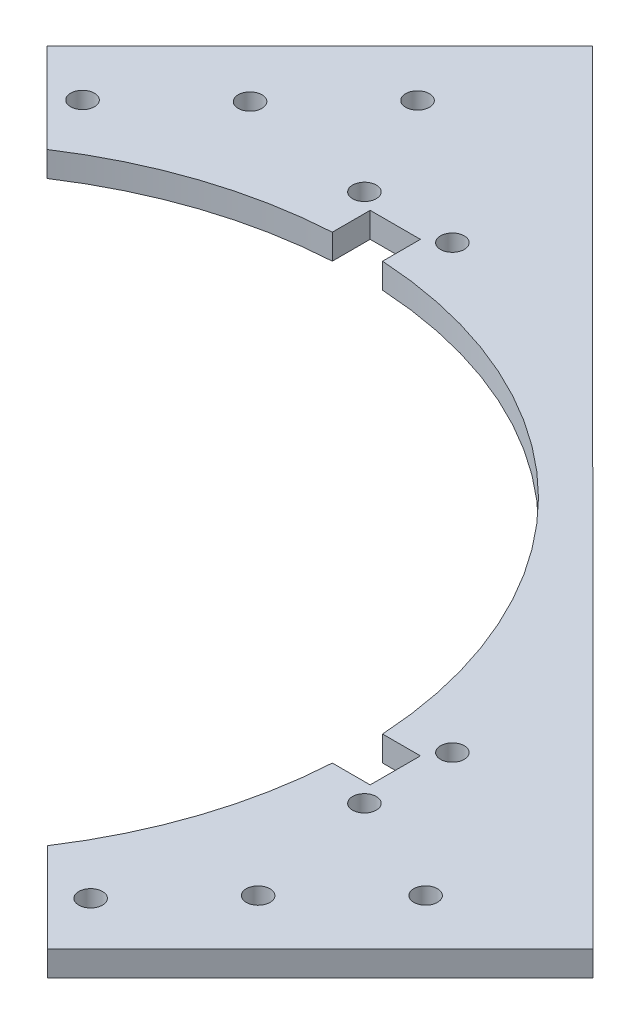
from build123d import *

# Parameters (mm, degrees)
SKETCH1_R           = 1.5
SKETCH1_R_2         = 55
BOSS_EXTRUDE1_DEPTH = 3.175
CUT_EXTRUDE3_DEPTH  = 140.736059076
CUT_EXTRUDE4_DEPTH  = 140.736059076
CUT_EXTRUDE5_DEPTH  = 140.736059076
SKETCH6_R           = 1.5
CUT_EXTRUDE6_DEPTH  = 130.738840902
CUT_EXTRUDE7_DEPTH  = 10


with BuildPart() as part:
    # Sketch1 → Boss-Extrude1 (new body)
    with BuildSketch(Plane(origin=(0, 0, 0), x_dir=(1, 0, 0), z_dir=(0, 1, 0))):
        Polygon((0.047005036, -98.782806148), (-98.782806148, -0.047005036), (-0.047005036, 98.782806148), (98.782806148, 0.047005036), align=None)
        with Locations(Location((-61.346730494, 5.55625, 0), (0, 0, 270))):
            Circle(SKETCH1_R, mode=Mode.SUBTRACT)
        with Locations(Location((-61.346730494, -5.55625, 0), (0, 0, 270))):
            Circle(SKETCH1_R, mode=Mode.SUBTRACT)
        with Locations(Location((-5.55625, -61.346730494, 0), (0, 0, 270))):
            Circle(SKETCH1_R, mode=Mode.SUBTRACT)
        with Locations(Location((5.55625, -61.346730494, 0), (0, 0, 270))):
            Circle(SKETCH1_R, mode=Mode.SUBTRACT)
        with Locations(Location((61.346730494, -5.55625, 0), (0, 0, 270))):
            Circle(SKETCH1_R, mode=Mode.SUBTRACT)
        with Locations(Location((61.346730494, 5.55625, 0), (0, 0, 270))):
            Circle(SKETCH1_R, mode=Mode.SUBTRACT)
        with Locations(Location((5.55625, 61.346730494, 0), (0, 0, 270))):
            Circle(SKETCH1_R, mode=Mode.SUBTRACT)
        with Locations(Location((-5.55625, 61.346730494, 0), (0, 0, 270))):
            Circle(SKETCH1_R, mode=Mode.SUBTRACT)
        with Locations(Location((0, 0, 0), (0, 0, 270))):
            Circle(SKETCH1_R_2, mode=Mode.SUBTRACT)
    extrude(amount=BOSS_EXTRUDE1_DEPTH)

    # Sketch2 → Cut-Extrude3 (cut, through all)
    with BuildSketch(Plane(origin=(0, 3.175, 0), x_dir=(1, 0, 0), z_dir=(0, 1, 0))):
        Polygon((3.175, 53.34), (3.175, 59.69), (-3.175, 59.69), (-3.175, 53.34), (-3.175, 52.244537665), (3.175, 52.244537665), align=None)
        Polygon((53.34, -3.175), (59.69, -3.175), (59.69, 3.175), (53.34, 3.175), (52.244537665, 3.175), (52.244537665, -3.175), align=None)
        Polygon((-3.175, -53.34), (-3.175, -59.69), (3.175, -59.69), (3.175, -53.34), (3.175, -52.244537665), (-3.175, -52.244537665), align=None)
        Polygon((-53.34, 3.175), (-59.69, 3.175), (-59.69, -3.175), (-53.34, -3.175), (-52.244537665, -3.175), (-52.244537665, 3.175), align=None)
    extrude(amount=-CUT_EXTRUDE3_DEPTH, mode=Mode.SUBTRACT)

    # Sketch3 → Cut-Extrude4 (cut, through all)
    with BuildSketch(Plane(origin=(0, 3.175, 0), x_dir=(1, 0, 0), z_dir=(0, 1, 0))):
        Polygon((-49.414905592, 49.367900556), (49.414905592, -49.367900556), (0.047005036, -98.782806148), (-98.782806148, -0.047005036), align=None)
    extrude(amount=-CUT_EXTRUDE4_DEPTH, mode=Mode.SUBTRACT)

    # Sketch5 → Cut-Extrude5 (cut, through all)
    with BuildSketch(Plane(origin=(0, 3.175, 0), x_dir=(1, 0, 0), z_dir=(0, 1, 0))):
        Polygon((98.782806148, 0.047005036), (91.71510385, -7.027426688), (-7.114707335, 91.708374424), (-0.047005036, 98.782806148), align=None)
    extrude(amount=-CUT_EXTRUDE5_DEPTH, mode=Mode.SUBTRACT)

    # Sketch6 → Cut-Extrude6 (cut, through all)
    with BuildSketch(Plane(origin=(0, 3.175, 0), x_dir=(1, 0, 0), z_dir=(0, 1, 0))):
        with Locations(Location((64.725061333, -22.363275374, 0), (0, 0, 270))):
            Circle(SKETCH6_R)
        with Locations(Location((75.300110897, -11.778156907, 0), (0, 0, 270))):
            Circle(SKETCH6_R)
        with Locations(Location((-12.20223816, 74.702563661, 0), (0, 0, 90))):
            Circle(SKETCH6_R)
        with Locations(Location((-22.662437607, 64.003936002, 0), (0, 0, 90))):
            Circle(SKETCH6_R)
        with Locations(Location((54.443600685, -33.241703487, 0), (0, 0, 270))):
            Circle(SKETCH6_R)
        with Locations(Location((-33.419374261, 53.595432504, 0), (0, 0, 90))):
            Circle(SKETCH6_R)
    extrude(amount=-CUT_EXTRUDE6_DEPTH, mode=Mode.SUBTRACT)

    # Sketch7 → Cut-Extrude7 (cut)
    with BuildSketch(Plane(origin=(0, 3.175, 0), x_dir=(1, 0, 0), z_dir=(0, 1, 0))):
        Polygon((49.414905592, -49.367900556), (57.268889772, -41.506438303), (-41.560921413, 57.229362809), (-49.414905592, 49.367900556), align=None)
    extrude(amount=-CUT_EXTRUDE7_DEPTH, mode=Mode.SUBTRACT)


solid = part.part
